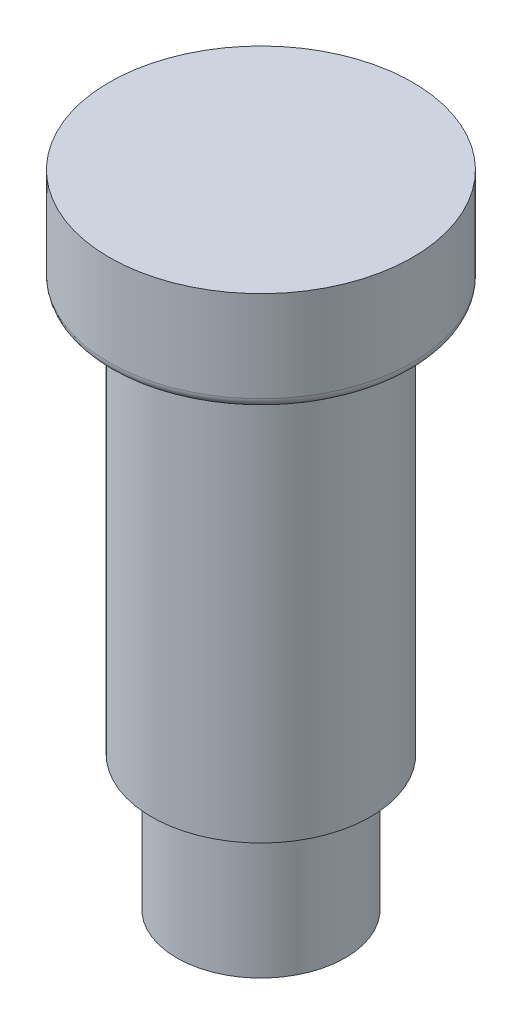
from build123d import *

# Parameters (mm, degrees)
ESBO_O1_R                = 4.5
RESSALTO_EXTRUS_O1_DEPTH = 3
ESBO_O2_R                = 3.25
RESSALTO_EXTRUS_O2_DEPTH = 12
ESBO_O3_R                = 2.5
RESSALTO_EXTRUS_O3_DEPTH = 4
FILETE2_R                = 0.3


with BuildPart() as part:
    # Esboço1 → Ressalto-extrusão1 (new body)
    with BuildSketch(Plane(origin=(0, 0, 0), x_dir=(1, 0, 0), z_dir=(0, 1, 0))):
        with Locations(Location((0, 0, 0), (0, 0, 270))):
            Circle(ESBO_O1_R)
    extrude(amount=RESSALTO_EXTRUS_O1_DEPTH)

    # Esboço2 → Ressalto-extrusão2 (add)
    with BuildSketch(Plane.XZ):
        with Locations(Location((0, 0, 0), (0, 0, 270))):
            Circle(ESBO_O2_R)
    extrude(amount=RESSALTO_EXTRUS_O2_DEPTH)

    # Esboço3 → Ressalto-extrusão3 (add)
    with BuildSketch(Plane.XZ.offset(12)):
        with Locations(Location((0, 0, 0), (0, 0, 270))):
            Circle(ESBO_O3_R)
    extrude(amount=RESSALTO_EXTRUS_O3_DEPTH)

    # Filete2
    filete2_edges = [part.edges().sort_by_distance(p)[0] for p in [
        (0, 0, -4.5),
    ]]
    fillet(filete2_edges, radius=FILETE2_R)


solid = part.part
